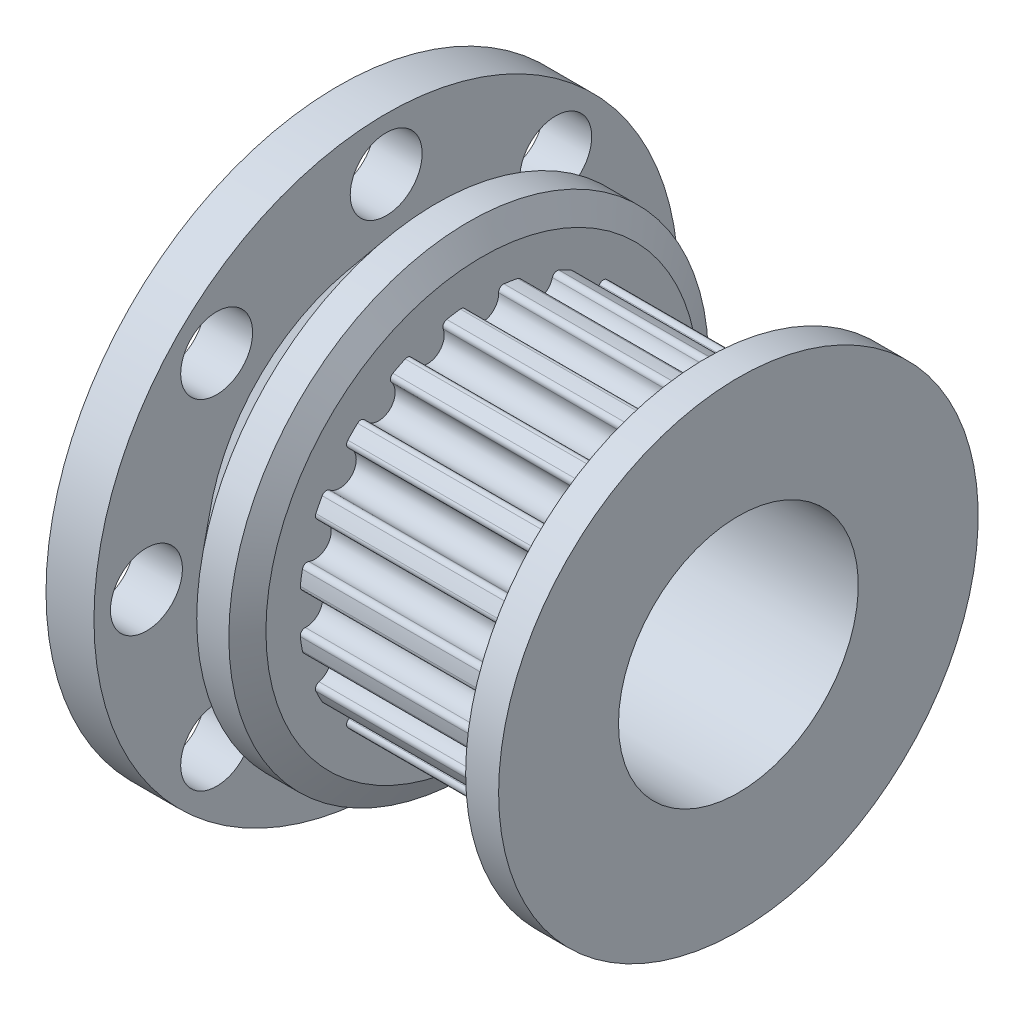
from build123d import *

# Parameters (mm, degrees)
SKETCH_2_R            = 3.175
BORE_DEPTH            = 17.311422378
SKETCH_3_R            = 0.55
CUT_EXTRUDE_20T_DEPTH = 7
FILLET_2_R            = 0.16
SKETCH4_R             = 9.75
BOSS_EXTRUDE3_DEPTH   = 1.6
SKETCH5_R             = 4
CUT_EXTRUDE3_DEPTH    = 20.192381301
CUT_EXTRUDE4_REACH    = 21.192
SKETCH11_R            = 1.2
CIRPATTERN1_COUNT     = 8
BOSS_EXTRUDE4_REACH   = 21.192
SKETCH12_R            = 4.536298995
SKETCH12_R_2          = 4.231357606


with BuildPart() as part:
    # Эскиз1 → Body (revolve)
    with BuildSketch(Plane.XY, mode=Mode.PRIVATE) as body_sk:
        Polygon((0, 6), (0, 0), (11.75, 0), (11.75, 4.231357606), (11.597529306, 4.383828301), (11.75, 4.536298995), (11.75, 8), (10.650291734, 8), (10.2, 7.213189396), (10.2, 6.11), (3.2, 6.11), (3.2, 7.213189396), (2.749708266, 8), (1.678199262, 8), align=None)
    revolve(body_sk.sketch.rotate(Axis((0, 0, 0), (1, 0, 0)), 90), axis=Axis((0, 0, 0), (1, 0, 0)))

    # Эскиз2 → Bore (cut, through all)
    with BuildSketch(Plane(origin=(11.75, 0, 0), x_dir=(0, 0, -1), z_dir=(1, 0, 0))):
        Circle(SKETCH_2_R)
    extrude(amount=-BORE_DEPTH, mode=Mode.SUBTRACT)

    # Эскиз3 → 20T (cut)
    with BuildSketch(Plane(origin=(3.2, 0, 0), x_dir=(0, 0, -1), z_dir=(1, 0, 0))):
        with Locations((5.582701751, -1.813929757)):
            Circle(SKETCH_3_R)
        with Locations((4.748929757, -3.450299431)):
            Circle(SKETCH_3_R)
        with Locations((3.450299431, -4.748929757)):
            Circle(SKETCH_3_R)
        with Locations((1.813929757, -5.582701751)):
            Circle(SKETCH_3_R)
        with Locations((0, -5.87)):
            Circle(SKETCH_3_R)
        with Locations((5.87, 0)):
            Circle(SKETCH_3_R)
        with Locations((-1.813929757, -5.582701751)):
            Circle(SKETCH_3_R)
        with Locations((-3.450299431, -4.748929757)):
            Circle(SKETCH_3_R)
        with Locations((-4.748929757, -3.450299431)):
            Circle(SKETCH_3_R)
        with Locations((-5.582701751, -1.813929757)):
            Circle(SKETCH_3_R)
        with Locations((-5.87, 0)):
            Circle(SKETCH_3_R)
        with Locations((-5.582701751, 1.813929757)):
            Circle(SKETCH_3_R)
        with Locations((-4.748929757, 3.450299431)):
            Circle(SKETCH_3_R)
        with Locations((-3.450299431, 4.748929757)):
            Circle(SKETCH_3_R)
        with Locations((-1.813929757, 5.582701751)):
            Circle(SKETCH_3_R)
        with Locations((0, 5.87)):
            Circle(SKETCH_3_R)
        with Locations((1.813929757, 5.582701751)):
            Circle(SKETCH_3_R)
        with Locations((3.450299431, 4.748929757)):
            Circle(SKETCH_3_R)
        with Locations((4.748929757, 3.450299431)):
            Circle(SKETCH_3_R)
        with Locations((5.582701751, 1.813929757)):
            Circle(SKETCH_3_R)
    extrude(amount=CUT_EXTRUDE_20T_DEPTH, mode=Mode.SUBTRACT)

    # Fillet 2
    fillet_2_edges = [part.edges().sort_by_distance(p)[0] for p in [
        (6.7, -4.629704566, 3.987221543),
        (6.7, -5.22273042, 3.170991479),
        (6.7, -3.170991479, 5.22273042),
        (6.7, -3.987221543, 4.629704566),
        (6.7, -1.401879653, 5.947002055),
        (6.7, -2.36141564, 5.635229913),
        (6.7, 0.504457922, 6.089139693),
        (6.7, -0.504457922, 6.089139693),
        (6.7, 2.36141564, 5.635229913),
        (6.7, 1.401879653, 5.947002055),
        (6.7, 3.987221543, 4.629704566),
        (6.7, 3.170991479, 5.22273042),
        (6.7, 5.22273042, 3.170991479),
        (6.7, 4.629704566, 3.987221543),
        (6.7, 5.947002055, 1.401879653),
        (6.7, 5.635229913, 2.36141564),
        (6.7, 6.089139693, -0.504457922),
        (6.7, 6.089139693, 0.504457922),
        (6.7, 5.635229913, -2.36141564),
        (6.7, 5.947002055, -1.401879653),
        (6.7, 4.629704566, -3.987221543),
        (6.7, 5.22273042, -3.170991479),
        (6.7, 3.170991479, -5.22273042),
        (6.7, 3.987221543, -4.629704566),
        (6.7, 1.401879653, -5.947002055),
        (6.7, 2.36141564, -5.635229913),
        (6.7, -2.36141564, -5.635229913),
        (6.7, -1.401879653, -5.947002055),
        (6.7, -3.987221543, -4.629704566),
        (6.7, -3.170991479, -5.22273042),
        (6.7, -5.22273042, -3.170991479),
        (6.7, -4.629704566, -3.987221543),
        (6.7, -5.947002055, -1.401879653),
        (6.7, -5.635229913, -2.36141564),
        (6.7, -6.089139693, 0.504457922),
        (6.7, -6.089139693, -0.504457922),
        (6.7, -0.504457922, -6.089139693),
        (6.7, 0.504457922, -6.089139693),
        (6.7, -5.635229913, 2.36141564),
        (6.7, -5.947002055, 1.401879653),
    ]]
    fillet(fillet_2_edges, radius=FILLET_2_R)

    # Sketch4 → Boss-Extrude3 (add)
    with BuildSketch(Plane.ZY):
        Circle(SKETCH4_R)
    extrude(amount=BOSS_EXTRUDE3_DEPTH)

    # Sketch5 → Cut-Extrude3 (cut, through all)
    with BuildSketch(Plane.ZY.offset(1.6)):
        Circle(SKETCH5_R)
    extrude(amount=-CUT_EXTRUDE3_DEPTH, mode=Mode.SUBTRACT)

    # Sketch11 → Cut-Extrude4 (cut, up to next)
    with BuildSketch(Plane.ZY.offset(1.6), mode=Mode.PRIVATE) as cut_extrude4_sk1:
        with Locations((8, 0)):
            Circle(SKETCH11_R)
    cut_extrude4_tool1 = extrude(cut_extrude4_sk1.sketch, amount=-CUT_EXTRUDE4_REACH, mode=Mode.PRIVATE) & part.part
    cut_extrude4 = cut_extrude4_tool1.solids().sort_by_distance((-1.6, 0, 8))[0]
    add(cut_extrude4, mode=Mode.SUBTRACT)

    # CirPattern1: Cut-Extrude4 ×8 about axis
    cirpattern1_axis = Axis((0, 0, 0), (1, 0, 0))
    for i in range(1, CIRPATTERN1_COUNT):
        add(cut_extrude4.rotate(cirpattern1_axis, i * 360 / CIRPATTERN1_COUNT), mode=Mode.SUBTRACT)

    # Sketch12 → Boss-Extrude4 (add, up to next)
    with BuildSketch(Plane(origin=(11.75, 0, 0), x_dir=(0, 0, -1), z_dir=(1, 0, 0)), mode=Mode.PRIVATE) as boss_extrude4_sk1:
        Circle(SKETCH12_R)
        Circle(SKETCH12_R_2, mode=Mode.SUBTRACT)
    boss_extrude4_tool1 = extrude(boss_extrude4_sk1.sketch, amount=-BOSS_EXTRUDE4_REACH, mode=Mode.PRIVATE) - part.part
    add(boss_extrude4_tool1.solids().sort_by_distance((11.75, 0, 4.407993))[0])


solid = part.part
